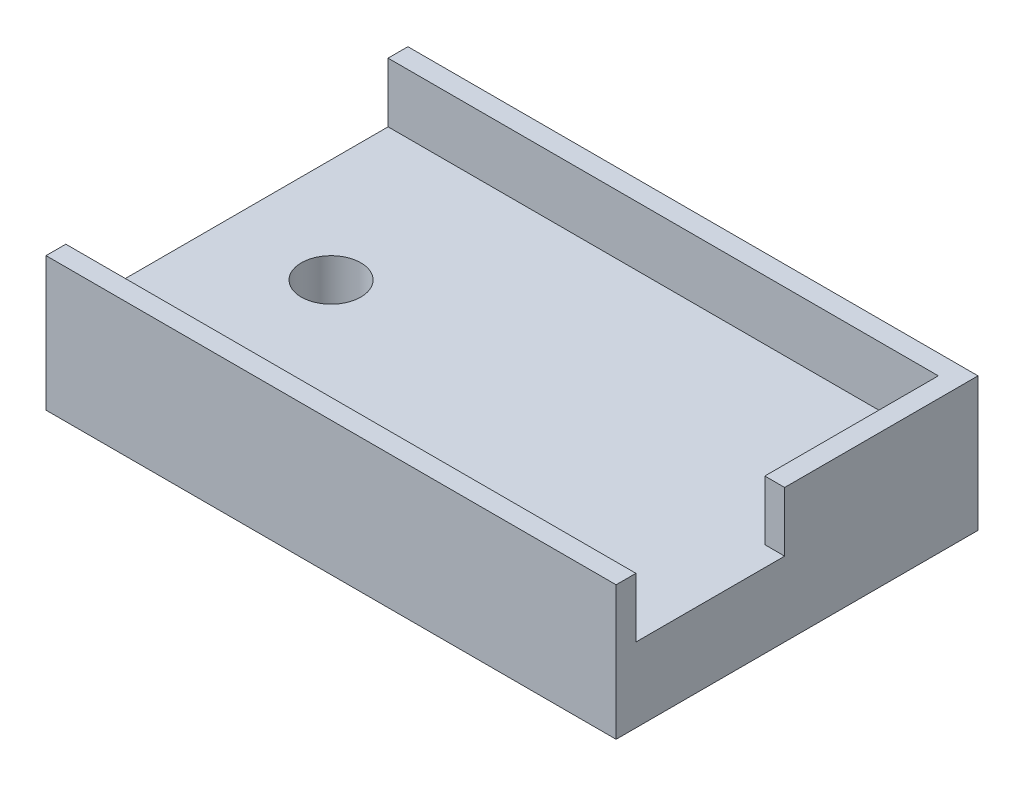
from build123d import *

# Parameters (mm, degrees)
SKETCH1_W           = 23
SKETCH1_H           = 14.6
BOSS_EXTRUDE1_DEPTH = 3
SKETCH2_R           = 1.2
CUT_EXTRUDE1_DEPTH  = 14.947759677
SKETCH3_W           = 23
SKETCH3_H           = 0.8
BOSS_EXTRUDE2_DEPTH = 2.4


with BuildPart() as part:
    # Sketch1 → Boss-Extrude1 (new body)
    with BuildSketch(Plane(origin=(0, 0, 0), x_dir=(1, 0, 0), z_dir=(0, 1, 0))):
        Rectangle(SKETCH1_W, SKETCH1_H)
    extrude(amount=BOSS_EXTRUDE1_DEPTH)

    # Sketch2 → Cut-Extrude1 (cut, through all)
    with BuildSketch(Plane(origin=(0, 3, 0), x_dir=(1, 0, 0), z_dir=(0, 1, 0))):
        with Locations(Location((-7.3, 0, 0), (0, 0, 270))):
            Circle(SKETCH2_R)
    extrude(amount=-CUT_EXTRUDE1_DEPTH, mode=Mode.SUBTRACT)

    # Sketch3 → Boss-Extrude2 (add)
    with BuildSketch(Plane(origin=(0, 3, 0), x_dir=(1, 0, 0), z_dir=(0, 1, 0))):
        Polygon((-11.5, 7.3), (11.5, 7.3), (11.5, -0.5), (10.7, -0.5), (10.7, 6.5), (-11.5, 6.5), align=None)
        with Locations((0, -6.9)):
            Rectangle(SKETCH3_W, SKETCH3_H)
    extrude(amount=BOSS_EXTRUDE2_DEPTH)


solid = part.part
